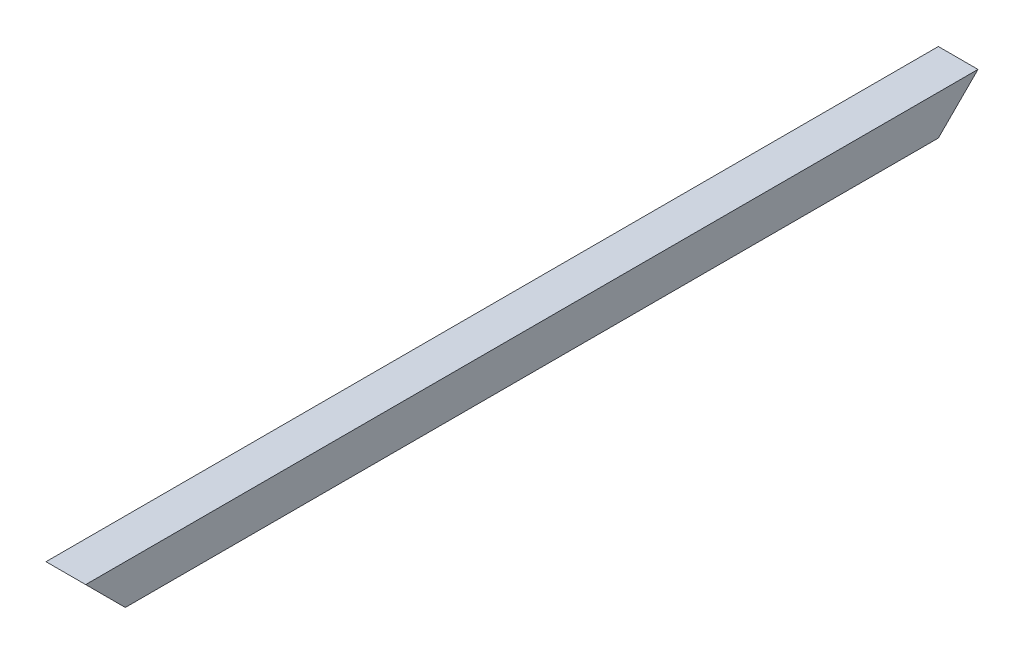
from build123d import *

# Parameters (mm, degrees)
SKETCH1_W               = 100
SKETCH1_H               = 100
SKETCH1_W_2             = 90
SKETCH1_H_2             = 90
BOSS_EXTRUDE1_DEPTH     = 1125
CUT_EXTRUDE1_DEPTH      = 1128.22003176
CUT_EXTRUDE1_DEPTH_BACK = 1128.22003176


with BuildPart() as part:
    # Sketch1 → Boss-Extrude1 (new, symmetric)
    with BuildSketch(Plane.XY):
        Rectangle(SKETCH1_W, SKETCH1_H)
        Rectangle(SKETCH1_W_2, SKETCH1_H_2, mode=Mode.SUBTRACT)
    extrude(amount=BOSS_EXTRUDE1_DEPTH, both=True)

    # Sketch4 → Cut-Extrude1 (cut, two sides: drawn at the far end of the back side and taken through both)
    with BuildSketch(Plane(origin=(0, 0, 0), x_dir=(0, 0, -1), z_dir=(1, 0, 0)).offset(-CUT_EXTRUDE1_DEPTH_BACK)):
        Polygon((-1125, 50), (-1025, -50), (-1125, -50), align=None)
        Polygon((1125, 50), (1025, -50), (1125, -50), align=None)
    extrude(amount=CUT_EXTRUDE1_DEPTH + CUT_EXTRUDE1_DEPTH_BACK, mode=Mode.SUBTRACT)


solid = part.part
